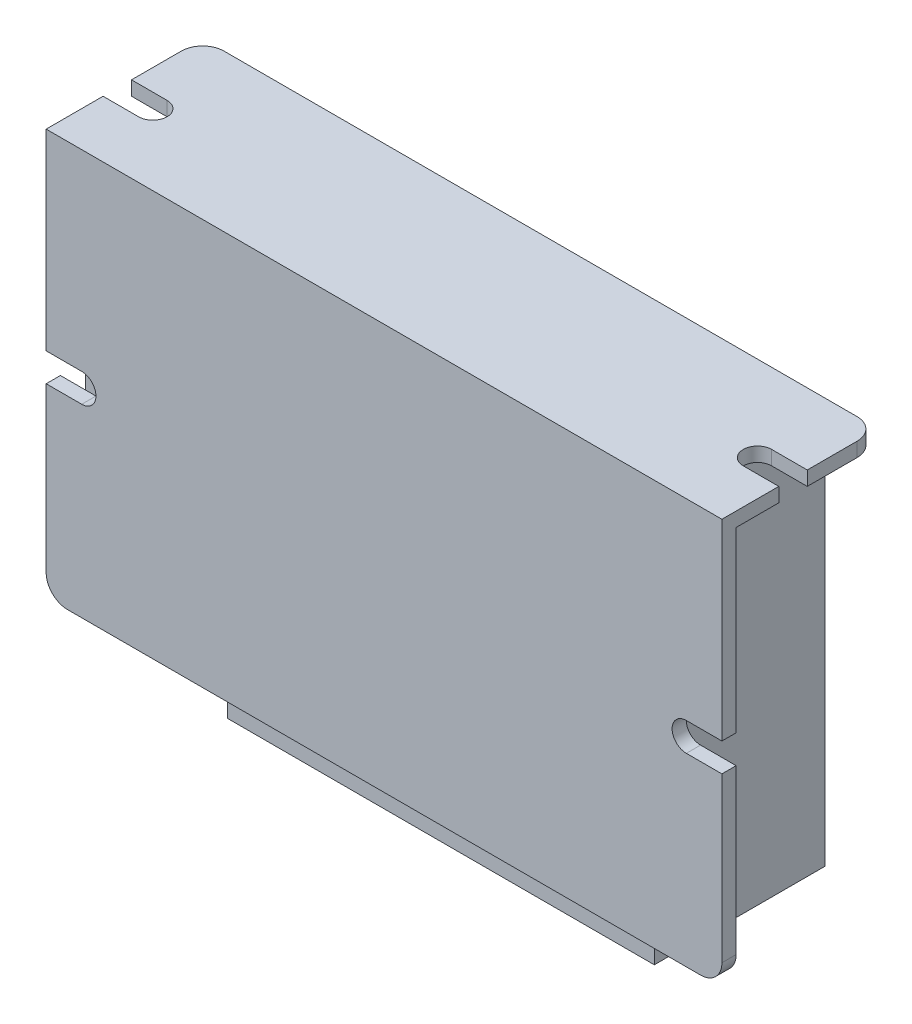
from build123d import *

# Parameters (mm, degrees)
SKETCH_1_W          = 80
SKETCH_1_H          = 55
EXTRUDE_1_DEPTH     = 20
EXTRUDE_2_DEPTH     = 2
SKETCH_3_W          = 95
SKETCH_3_H          = 2
EXTRUDE_3_DEPTH     = 55
EXTRUDE_4_DEPTH     = 30
CUT_EXTRUDE_1_DEPTH = 84.458073306
CUT_EXTRUDE_2_DEPTH = 65.058566952
FILLET_1_R          = 3
EXTRUDE_5_DEPTH     = 15


with BuildPart() as part:
    # 草图1 → 凸台-拉伸1 (new body)
    with BuildSketch(Plane.XY):
        Rectangle(SKETCH_1_W, SKETCH_1_H)
    extrude(amount=EXTRUDE_1_DEPTH)



with BuildPart() as body_2:
    # 草图2 → 凸台-拉伸2 (new body)
    with BuildSketch(Plane(origin=(0, 27.5, 0), x_dir=(1, 0, 0), z_dir=(0, 1, 0))):
        Polygon((-47.5, 0), (-47.5, -22), (47.5, -22), (47.5, 0), (40, 0), (-40, 0), align=None)
    extrude(amount=EXTRUDE_2_DEPTH)


with BuildPart() as part_1:
    add(part.part)

    add(body_2.part)  # 凸台-拉伸3 merges body 2
    # 草图3 → 凸台-拉伸3 (add)
    with BuildSketch(Plane.XZ.offset(-27.5)):
        with Locations((0, 21)):
            Rectangle(SKETCH_3_W, SKETCH_3_H)
    extrude(amount=EXTRUDE_3_DEPTH)

    # 草图4 → 凸台-拉伸4 (add, symmetric)
    with BuildSketch(Plane(origin=(0, 0, 0), x_dir=(0, 0, -1), z_dir=(1, 0, 0))):
        Polygon((-1, -27.5), (-1, -28.5), (1, -28.5), (1, -37.5), (-14, -37.5), (-14, -27.5), align=None)
    extrude(amount=EXTRUDE_4_DEPTH, both=True)

    # 草图5 → 切除-拉伸1 (cut, through all)
    with BuildSketch(Plane.XZ.offset(-27.5)):
        with BuildLine():
            Line((52.5, 10), (42.5, 10))
            ThreePointArc((42.5, 10), (40.5, 12), (42.5, 14))
            Line((42.5, 14), (52.5, 14))
            ThreePointArc((52.5, 14), (54.5, 12), (52.5, 10))
        make_face()
    cut_extrude_1 = extrude(amount=-CUT_EXTRUDE_1_DEPTH, mode=Mode.SUBTRACT)

    # 草图6 → 切除-拉伸2 (cut, through all)
    with BuildSketch(Plane(origin=(0, 0, 20), x_dir=(-1, 0, 0), z_dir=(0, 0, -1))):
        with BuildLine():
            Line((-52.5, 2.5), (-42.5, 2.5))
            ThreePointArc((-42.5, 2.5), (-40.5, 0.5), (-42.5, -1.5))
            Line((-42.5, -1.5), (-52.5, -1.5))
            ThreePointArc((-52.5, -1.5), (-54.5, 0.5), (-52.5, 2.5))
        make_face()
    cut_extrude_2 = extrude(amount=-CUT_EXTRUDE_2_DEPTH, mode=Mode.SUBTRACT)

    # 镜向1: 切除-拉伸1, 切除-拉伸2 across plane
    add(cut_extrude_1.mirror(Plane(origin=(0, 0, 0), x_dir=(0, 0, 1), z_dir=(1, 0, 0))), mode=Mode.SUBTRACT)
    add(cut_extrude_2.mirror(Plane(origin=(0, 0, 0), x_dir=(0, 0, 1), z_dir=(1, 0, 0))), mode=Mode.SUBTRACT)

    # 圆角1
    fillet_1_edges = [part_1.edges().sort_by_distance(p)[0] for p in [
        (47.5, -27.5, 21),
        (-47.5, -27.5, 21),
        (47.5, 28.5, 0),
        (-47.5, 28.5, 0),
    ]]
    fillet(fillet_1_edges, radius=FILLET_1_R)

    # 草图7 → 凸台-拉伸5 (add)
    with BuildSketch(Plane(origin=(0, 5.5, 0), x_dir=(-1, 0, 0), z_dir=(0, -1, 0))):
        Polygon((40, -1), (41, -1), (41, 1), (50, 1), (50, -14), (40, -14), align=None)
    extrude(amount=EXTRUDE_5_DEPTH)


solid = part_1.part
